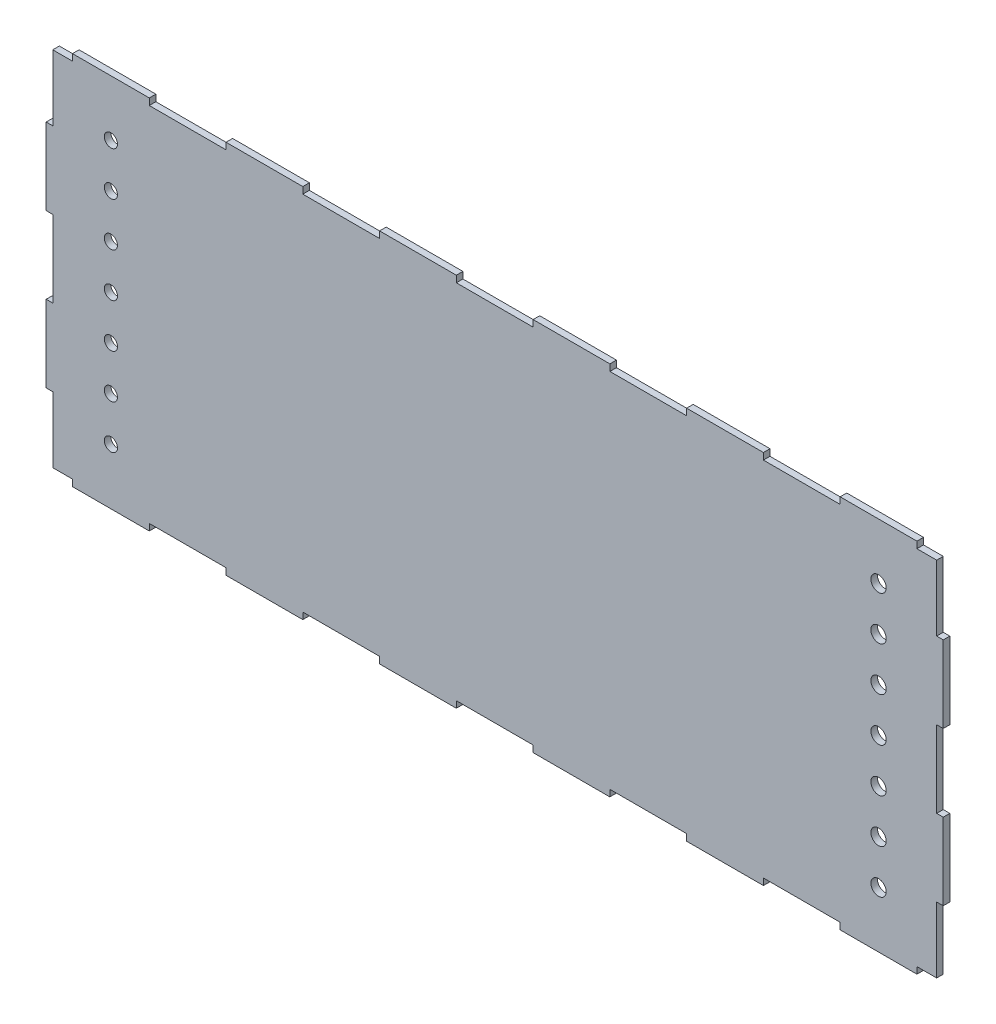
from build123d import *

# Parameters (mm, degrees)
BOSS_EXTRUDE1_DEPTH = 3
SKETCH1_R           = 3
SKETCH1_R_2         = 3.5
CUT_EXTRUDE1_DEPTH  = 222.674310645


with BuildPart() as part:
    # Model → Boss-Extrude1 (new body)
    with BuildSketch(Plane.XY):
        Polygon((192.5, 85.5), (157.5, 85.5), (157.5, 82.5), (122.5, 82.5), (122.5, 85.5), (87.5, 85.5), (87.5, 82.5), (52.5, 82.5), (52.5, 85.5), (17.5, 85.5), (17.5, 82.5), (-17.5, 82.5), (-17.5, 85.5), (-52.5, 85.5), (-52.5, 82.5), (-87.5, 82.5), (-87.5, 85.5), (-122.5, 85.5), (-122.5, 82.5), (-157.5, 82.5), (-157.5, 85.5), (-192.5, 85.5), (-192.5, 82.5), (-201.5, 82.5), (-201.5, 52.5), (-204.5, 52.5), (-204.5, 17.5), (-201.5, 17.5), (-201.5, -17.5), (-204.5, -17.5), (-204.5, -52.5), (-201.5, -52.5), (-201.5, -82.5), (-192.5, -82.5), (-192.5, -85.5), (-157.5, -85.5), (-157.5, -82.5), (-122.5, -82.5), (-122.5, -85.5), (-87.5, -85.5), (-87.5, -82.5), (-52.5, -82.5), (-52.5, -85.5), (-17.5, -85.5), (-17.5, -82.5), (17.5, -82.5), (17.5, -85.5), (52.5, -85.5), (52.5, -82.5), (87.5, -82.5), (87.5, -85.5), (122.5, -85.5), (122.5, -82.5), (157.5, -82.5), (157.5, -85.5), (192.5, -85.5), (192.5, -82.5), (201.5, -82.5), (201.5, -52.5), (204.5, -52.5), (204.5, -17.5), (201.5, -17.5), (201.5, 17.5), (204.5, 17.5), (204.5, 52.5), (201.5, 52.5), (201.5, 82.5), (192.5, 82.5), align=None)
    extrude(amount=BOSS_EXTRUDE1_DEPTH)

    # Sketch1 → Cut-Extrude1 (cut, through all)
    with BuildSketch(Plane.XY.offset(3)):
        with Locations((-175, 0)):
            Circle(SKETCH1_R)
        with Locations((175, 0)):
            Circle(SKETCH1_R_2)
        with Locations((-175, 20)):
            Circle(SKETCH1_R)
        with Locations((175, 20)):
            Circle(SKETCH1_R_2)
        with Locations((-175, 40)):
            Circle(SKETCH1_R)
        with Locations((175, 40)):
            Circle(SKETCH1_R_2)
        with Locations((-175, 60)):
            Circle(SKETCH1_R)
        with Locations((175, 60)):
            Circle(SKETCH1_R_2)
        with Locations((-175, -20)):
            Circle(SKETCH1_R)
        with Locations((175, -20)):
            Circle(SKETCH1_R_2)
        with Locations((-175, -40)):
            Circle(SKETCH1_R)
        with Locations((175, -40)):
            Circle(SKETCH1_R_2)
        with Locations((-175, -60)):
            Circle(SKETCH1_R)
        with Locations((175, -60)):
            Circle(SKETCH1_R_2)
    extrude(amount=-CUT_EXTRUDE1_DEPTH, mode=Mode.SUBTRACT)


solid = part.part
